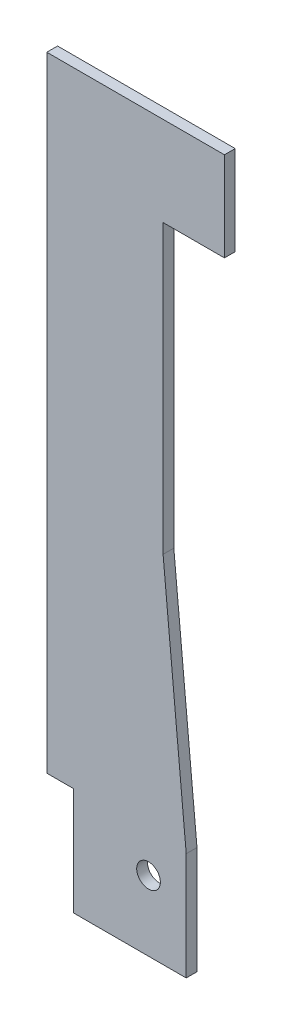
from build123d import *

# Parameters (mm, degrees)
EXTRUDE_2_DEPTH     = 1
SKETCH_1_5_W        = 5.5
SKETCH_1_5_H        = 10
SKETCH_1_5_W_2      = 4.949873967
SKETCH_1_5_R        = 1.1
EXTRUDE_3_DEPTH     = 1
SKETCH_3_W          = 3
SKETCH_3_H          = 58
CUT_EXTRUDE_1_DEPTH = 10


with BuildPart() as part:
    # 草图1 → 凸台-拉伸2 (new body)
    with BuildSketch(Plane.XY):
        Polygon((-5.588804059, 13.118731113), (-5.588804059, -12.701827406), (-5.588804059, -40.201827406), (-0.088804059, -40.201827406), (5.411195941, -40.201827406), (10.361069908, -40.201827406), (8.211195941, -17.197725842), (8.211195941, 9.5), (13.911195941, 9.5), (13.911195941, 12.5), (13.911195941, 17.798172594), (-5.588804059, 17.798172594), align=None)
    extrude(amount=EXTRUDE_2_DEPTH)

    # 草图1<5> → 凸台-拉伸3 (add)
    # profile 1 of 3: a face of its own
    with BuildSketch(Plane.XY):
        Polygon((-5.588804059, 13.118731113), (-5.588804059, -12.701827406), (-5.588804059, -40.201827406), (-0.088804059, -40.201827406), (5.411195941, -40.201827406), (10.361069908, -40.201827406), (8.211195941, -17.197725842), (8.211195941, 9.5), (13.911195941, 9.5), (13.911195941, 12.5), (13.911195941, 17.798172594), (-5.588804059, 17.798172594), align=None)
    # profile 2 of 3: a face of its own
    with BuildSketch(Plane.XY):
        with Locations((2.661195941, -45.201827406)):
            Rectangle(SKETCH_1_5_W, SKETCH_1_5_H)
    # profile 3 of 3: a face of its own
    with BuildSketch(Plane.XY):
        with Locations((7.886132925, -45.201827406)):
            Rectangle(SKETCH_1_5_W_2, SKETCH_1_5_H)
        with Locations((6.861069908, -43.701827406)):
            Circle(SKETCH_1_5_R, mode=Mode.SUBTRACT)
    extrude(amount=EXTRUDE_3_DEPTH)

    # 草图3 → 切除-拉伸1 (cut)
    with BuildSketch(Plane.XY.offset(1)):
        with Locations((-4.088804059, -11.201827406)):
            Rectangle(SKETCH_3_W, SKETCH_3_H)
    extrude(amount=-CUT_EXTRUDE_1_DEPTH, mode=Mode.SUBTRACT)


solid = part.part
